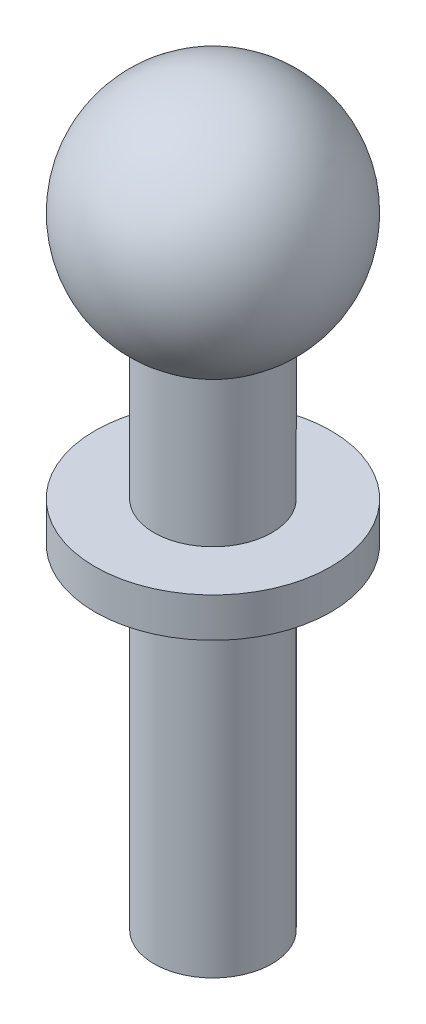
from build123d import *

# Parameters (mm, degrees)
M3_NECK_AND_THREAD_ENVELOPE_SKETCH_R = 1.5
M3_NECK_AND_THREAD_ENVELOPE_DEPTH    = 15.8
ANCHOR_SEATING_COLLAR_SKETCH_R       = 3
ANCHOR_SEATING_COLLAR_DEPTH          = 1
ANCHOR_TAIL_HEX_DRIVE_DEPTH          = 1.6


with BuildPart() as part:
    # M3 neck and thread envelope sketch → M3 neck and thread envelope (new body)
    with BuildSketch(Plane(origin=(0, -90, 0), x_dir=(-1, 0, 0), z_dir=(0, -1, 0))):
        with Locations(Location((23.382685902, 19, 0), (0, 0, 90))):
            Circle(M3_NECK_AND_THREAD_ENVELOPE_SKETCH_R)
    extrude(amount=M3_NECK_AND_THREAD_ENVELOPE_DEPTH)

    # Six millimetre anchor ball profile → Six millimetre anchor ball (revolve)
    with BuildSketch(Plane(origin=(0, -90, 0), x_dir=(-1, 0, 0), z_dir=(0, -1, 0))):
        with BuildLine():
            Line((23.382685902, 16), (23.382685902, 22))
            ThreePointArc((23.382685902, 22), (20.382685902, 19), (23.382685902, 16))
        make_face()
    revolve(axis=Axis((-23.382685902, -90, -29), (0, 0, 1)))

    # Anchor seating collar sketch → Anchor seating collar (add)
    with BuildSketch(Plane(origin=(0, -96.3, 0), x_dir=(-1, 0, 0), z_dir=(0, -1, 0))):
        with Locations(Location((23.382685902, 19, 0), (0, 0, 90))):
            Circle(ANCHOR_SEATING_COLLAR_SKETCH_R)
    extrude(amount=ANCHOR_SEATING_COLLAR_DEPTH)

    # Anchor tail hex drive sketch → Anchor tail hex drive (cut)
    with BuildSketch(Plane(origin=(0, -105.9, 0), x_dir=(1, 0, 0), z_dir=(0, 1, 0))):
        Polygon((-22.516660498, 19), (-22.9496732, 19.75), (-23.815698604, 19.75), (-24.248711306, 19), (-23.815698604, 18.25), (-22.9496732, 18.25), align=None)
    extrude(amount=ANCHOR_TAIL_HEX_DRIVE_DEPTH, mode=Mode.SUBTRACT)


solid = part.part
